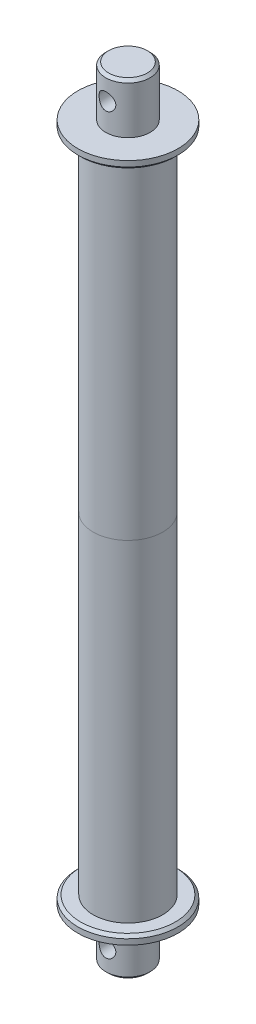
from build123d import *

# Parameters (mm, degrees)
SKETCH_1_R               = 7.95
EXTRUDE_1_DEPTH          = 18
CHAMFER_2_SIZE           = 1
CUT_EXTRUDE_2_DEPTH      = 22.22274723
CUT_EXTRUDE_2_DEPTH_BACK = 22.22274723
SKETCH_9_R               = 3
SKETCH_4_R               = 18
EXTRUDE_2_DEPTH          = 3
CHAMFER_1_SIZE           = 1
SKETCH_5_R               = 12.5
EXTRUDE_3_DEPTH          = 119


with BuildPart() as part:
    # 草图1 → 凸台-拉伸1 (new body)
    with BuildSketch(Plane(origin=(0, 0, 0), x_dir=(1, 0, 0), z_dir=(0, 1, 0))):
        with Locations(Location((0, 0, 0), (0, 0, 270))):
            Circle(SKETCH_1_R)
    extrude(amount=EXTRUDE_1_DEPTH)

    # 倒角2
    chamfer_2_edges = [part.edges().sort_by_distance(p)[0] for p in [
        (0, 18, -7.95),
    ]]
    chamfer(chamfer_2_edges, length=CHAMFER_2_SIZE)

    # 草图9 → 切除-拉伸2 (cut, two sides: drawn at the far end of the back side and taken through both)
    with BuildSketch(Plane.XY.offset(-CUT_EXTRUDE_2_DEPTH_BACK)):
        with Locations(Location((0, 9.7, 0), (0, 0, 89.999999999))):
            Circle(SKETCH_9_R)
    extrude(amount=CUT_EXTRUDE_2_DEPTH + CUT_EXTRUDE_2_DEPTH_BACK, mode=Mode.SUBTRACT)

    # 草图4 → 凸台-拉伸2 (add)
    with BuildSketch(Plane(origin=(0, 0, 0), x_dir=(1, 0, 0), z_dir=(0, 1, 0))):
        with Locations(Location((0, 0, 0), (0, 0, 270))):
            Circle(SKETCH_4_R)
    extrude(amount=-EXTRUDE_2_DEPTH)

    # 倒角1
    chamfer_1_edges = [part.edges().sort_by_distance(p)[0] for p in [
        (0, -3, -18),
    ]]
    chamfer(chamfer_1_edges, length=CHAMFER_1_SIZE)

    # 草图5 → 凸台-拉伸3 (add)
    with BuildSketch(Plane(origin=(0, -3, 0), x_dir=(-1, 0, 0), z_dir=(0, -1, 0))):
        with Locations(Location((0, 0, 0), (0, 0, 90))):
            Circle(SKETCH_5_R)
    extrude(amount=EXTRUDE_3_DEPTH)


with BuildPart() as body_2:
    # 镜向3: mirrored copy
    add(part.part.mirror(Plane(origin=(0, -122, 0), x_dir=(0, 0, 1), z_dir=(0, -1, 0))))


solid = Compound([part.part, body_2.part])
